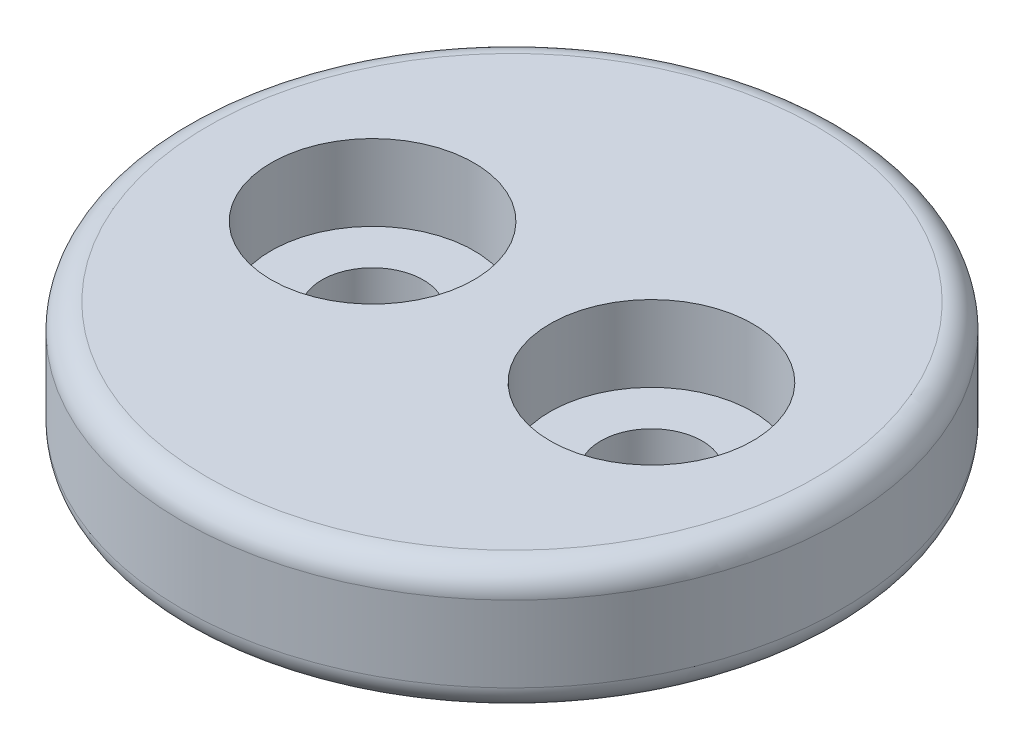
from build123d import *

# Parameters (mm, degrees)
SKETCH1_R           = 16.51
SKETCH1_R_2         = 2.54
BOSS_EXTRUDE1_DEPTH = 6.35
SKETCH2_R           = 5.08
CUT_EXTRUDE1_DEPTH  = 3.81
FILLET1_R           = 1.27


with BuildPart() as part:
    # Sketch1 → Boss-Extrude1 (new body)
    with BuildSketch(Plane(origin=(0, 0, 0), x_dir=(1, 0, 0), z_dir=(0, 1, 0))):
        with Locations(Location((0, 0, 0), (0, 0, 270))):
            Circle(SKETCH1_R)
        with Locations(Location((-6.985, 0, 0), (0, 0, 270))):
            Circle(SKETCH1_R_2, mode=Mode.SUBTRACT)
        with Locations(Location((6.985, 0, 0), (0, 0, 90))):
            Circle(SKETCH1_R_2, mode=Mode.SUBTRACT)
    extrude(amount=BOSS_EXTRUDE1_DEPTH)

    # Sketch2 → Cut-Extrude1 (cut)
    with BuildSketch(Plane(origin=(0, 6.35, 0), x_dir=(1, 0, 0), z_dir=(0, 1, 0))):
        with Locations(Location((-6.985, 0, 0), (0, 0, 270))):
            Circle(SKETCH2_R)
        with Locations(Location((6.985, 0, 0), (0, 0, 270))):
            Circle(SKETCH2_R)
    extrude(amount=-CUT_EXTRUDE1_DEPTH, mode=Mode.SUBTRACT)

    # Fillet1
    fillet1_edges = [part.edges().sort_by_distance(p)[0] for p in [
        (0, 0, -16.51),
        (0, 6.35, -16.51),
    ]]
    fillet(fillet1_edges, radius=FILLET1_R)


solid = part.part
